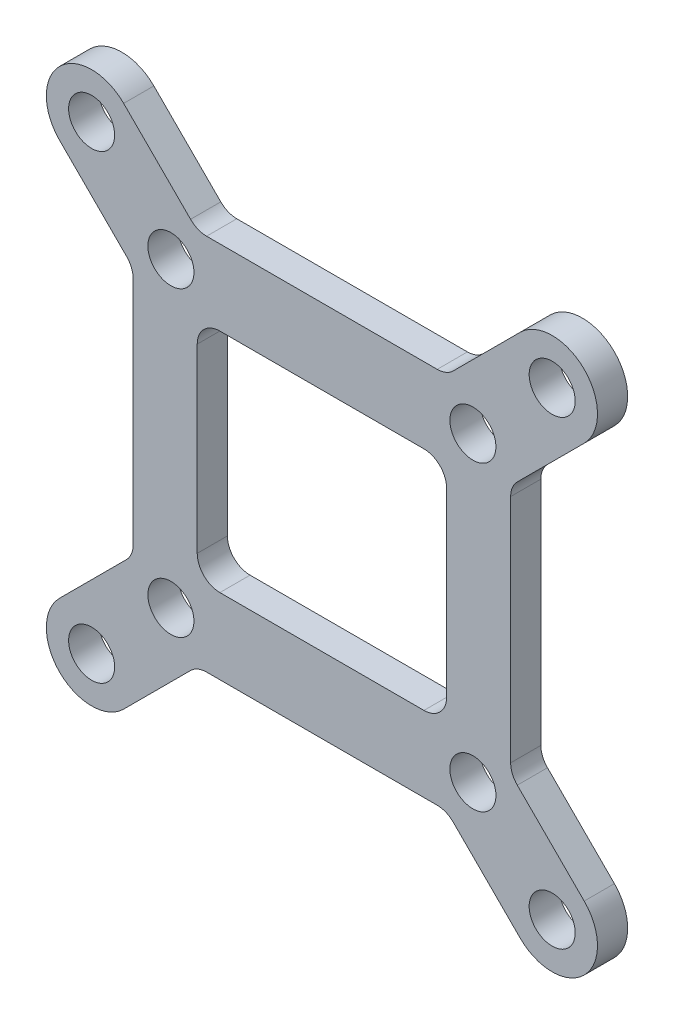
from build123d import *

# Parameters (mm, degrees)
SKETCH_1_R      = 1.525
SKETCH_1_W      = 16.514718626
SKETCH_1_H      = 15
EXTRUDE_1_DEPTH = 2
FILLET_1_R      = 1.5


with BuildPart() as part:
    # 草图1 → 凸台-拉伸1 (new body)
    with BuildSketch(Plane.XY):
        with BuildLine():
            Line((-8.257359313, 12.5), (8.257359313, 12.5))
            Line((8.257359313, 12.5), (13.128679656, 17.371320344))
            ThreePointArc((13.128679656, 17.371320344), (17.371320344, 17.371320344), (17.371320344, 13.128679656))
            Line((17.371320344, 13.128679656), (12.5, 8.257359313))
            Line((12.5, 8.257359313), (12.5, -8.257359313))
            Line((12.5, -8.257359313), (17.371320344, -13.128679656))
            ThreePointArc((17.371320344, -13.128679656), (17.371320344, -17.371320344), (13.128679656, -17.371320344))
            Line((13.128679656, -17.371320344), (8.257359313, -12.5))
            Line((8.257359313, -12.5), (-8.257359313, -12.5))
            Line((-8.257359313, -12.5), (-13.128679656, -17.371320344))
            ThreePointArc((-13.128679656, -17.371320344), (-17.371320344, -17.371320344), (-17.371320344, -13.128679656))
            Line((-17.371320344, -13.128679656), (-12.5, -8.257359313))
            Line((-12.5, -8.257359313), (-12.5, 8.257359313))
            Line((-12.5, 8.257359313), (-17.371320344, 13.128679656))
            ThreePointArc((-17.371320344, 13.128679656), (-17.371320344, 17.371320344), (-13.128679656, 17.371320344))
            Line((-13.128679656, 17.371320344), (-8.257359313, 12.5))
        make_face()
        with Locations((-15.25, 15.25)):
            Circle(SKETCH_1_R, mode=Mode.SUBTRACT)
        with Locations((15.25, 15.25)):
            Circle(SKETCH_1_R, mode=Mode.SUBTRACT)
        with Locations((-15.25, -15.25)):
            Circle(SKETCH_1_R, mode=Mode.SUBTRACT)
        with Locations((15.25, -15.25)):
            Circle(SKETCH_1_R, mode=Mode.SUBTRACT)
        with Locations((-10, 10)):
            Circle(SKETCH_1_R, mode=Mode.SUBTRACT)
        with Locations(Location((10, 10, 0), (0, 0, 180))):
            Circle(SKETCH_1_R, mode=Mode.SUBTRACT)
        with Locations((10, -10)):
            Circle(SKETCH_1_R, mode=Mode.SUBTRACT)
        with Locations(Location((-10, -10, 0), (0, 0, 180))):
            Circle(SKETCH_1_R, mode=Mode.SUBTRACT)
        Rectangle(SKETCH_1_W, SKETCH_1_H, mode=Mode.SUBTRACT)
    extrude(amount=EXTRUDE_1_DEPTH)

    # 圆角1
    fillet_1_edges = [part.edges().sort_by_distance(p)[0] for p in [
        (-8.257359313, 12.5, 1),
        (8.257359313, 12.5, 1),
        (12.5, 8.257359313, 1),
        (12.5, -8.257359313, 1),
        (8.257359313, -12.5, 1),
        (-8.257359313, -12.5, 1),
        (-12.5, -8.257359313, 1),
        (-12.5, 8.257359313, 1),
        (-8.257359313, 7.5, 1),
        (-8.257359313, -7.5, 1),
        (8.257359313, -7.5, 1),
        (8.257359313, 7.5, 1),
    ]]
    fillet(fillet_1_edges, radius=FILLET_1_R)


solid = part.part
